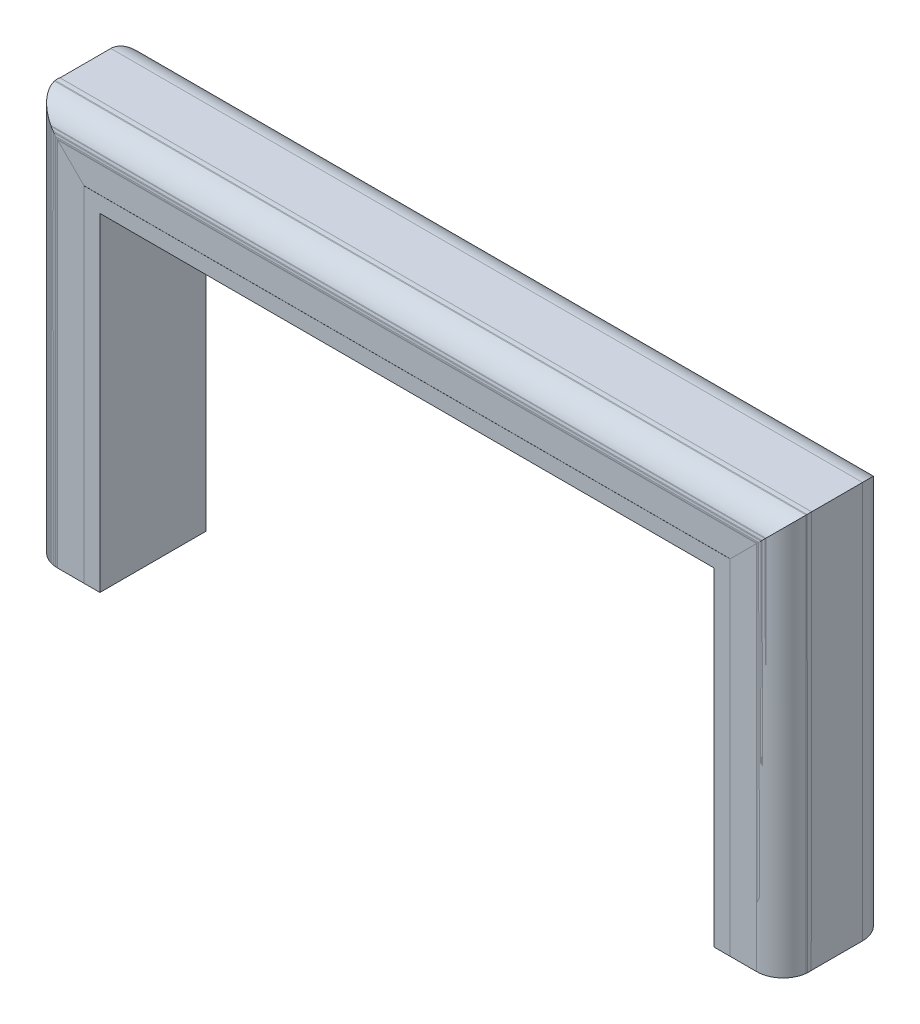
from build123d import *

# Parameters (mm, degrees)
PLYWOOD_DEPTH = 127
SKETCH2_R     = 31.75
SKETCH2_R_2   = 31.623


with BuildPart() as part:
    # Sketch1 → Plywood (new body)
    with BuildSketch(Plane.XY):
        Polygon((-387.35, 0), (-387.35, 412.75), (387.35, 412.75), (387.35, 0), (368.3, 0), (368.3, 393.7), (-368.3, 393.7), (-368.3, 0), align=None)
    extrude(amount=PLYWOOD_DEPTH)


with BuildPart() as body_2:
    # Sweep1: sweep along a path in Sketch3
    with BuildLine(Plane.XY.offset(95.25)) as sweep1_path:
        Line((-419.1, 0), (-419.1, 444.5))
        Line((-419.1, 444.5), (419.1, 444.5))
        Line((419.1, 444.5), (419.1, 0))
    # Sketch2 → Sweep1 (sweep)
    with BuildSketch(Plane.XZ):
        with Locations((-419.1, 95.25)):
            Circle(SKETCH2_R)
        with Locations((-418.973, 31.623)):
            Circle(SKETCH2_R_2)
    sweep(path=sweep1_path.line, transition=Transition.RIGHT)


with BuildPart() as body_3:
    # Sweep2: sweep along a path in Sketch4
    with BuildLine(Plane.XY.offset(31.623)) as sweep2_path:
        Line((-418.973, 0), (-418.973, 444.5))
        Line((-418.973, 444.5), (419.1, 444.5))
        Line((419.1, 444.5), (419.1, 0))
    # Sketch6 → Sweep2 (sweep)
    with BuildSketch(Plane.XZ):
        with BuildLine():
            Line((-418.973, 0), (-387.35, 0))
            Line((-387.35, 0), (-387.35, 127))
            Line((-387.35, 127), (-419.1, 127))
            ThreePointArc((-419.1, 127), (-440.085790865, 119.075597196), (-450.596, 99.258052395))
            Line((-450.596, 99.258052395), (-450.596, 91.241947605))
            Line((-450.596, 91.241947605), (-450.596, 31.623))
            ThreePointArc((-450.596, 31.623), (-441.333837741, 9.262162259), (-418.973, 0))
        make_face()
    sweep(path=sweep2_path.line, transition=Transition.RIGHT)


solid = Compound([part.part, body_2.part, body_3.part])
